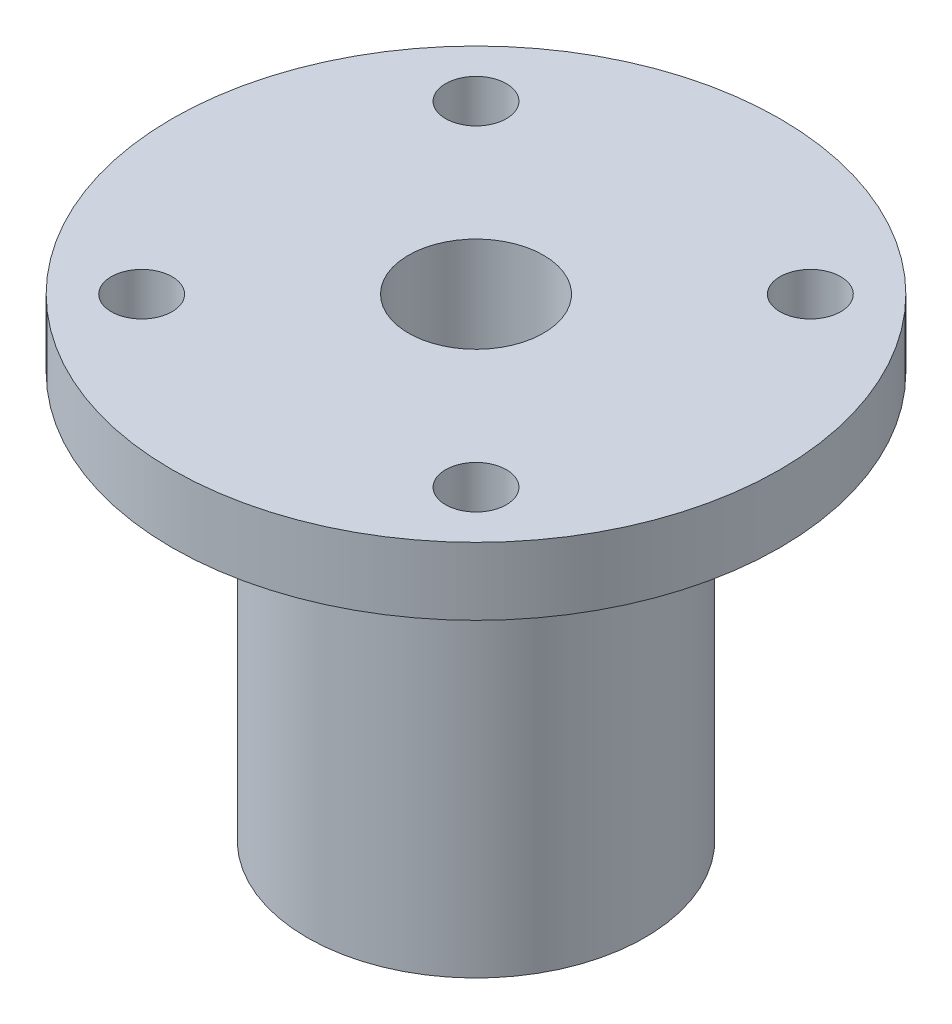
from build123d import *

# Parameters (mm, degrees)
HOLE_WIZARD_M41_D = 4.5


with BuildPart() as part:
    # Эскиз1 → Повернуть1 (revolve)
    with BuildSketch(Plane.XY, mode=Mode.PRIVATE) as revolve_1_sk:
        Polygon((5, 35), (22.5, 35), (22.5, 30), (12.5, 30), (12.5, 0), (5, 0), align=None)
    revolve(revolve_1_sk.sketch.rotate(Axis((0, 0, 0), (0, 1, 0)), 90), axis=Axis((0, 0, 0), (0, 1, 0)))

    # Отверстие с зазором M41 (through all)
    with Locations(Plane.XZ.offset(-30)):
        with Locations((-12.374368671, 12.374368671), (-12.374368671, -12.374368671), (12.374368671, -12.374368671), (12.374368671, 12.374368671)):
            Hole(HOLE_WIZARD_M41_D / 2)


solid = part.part
